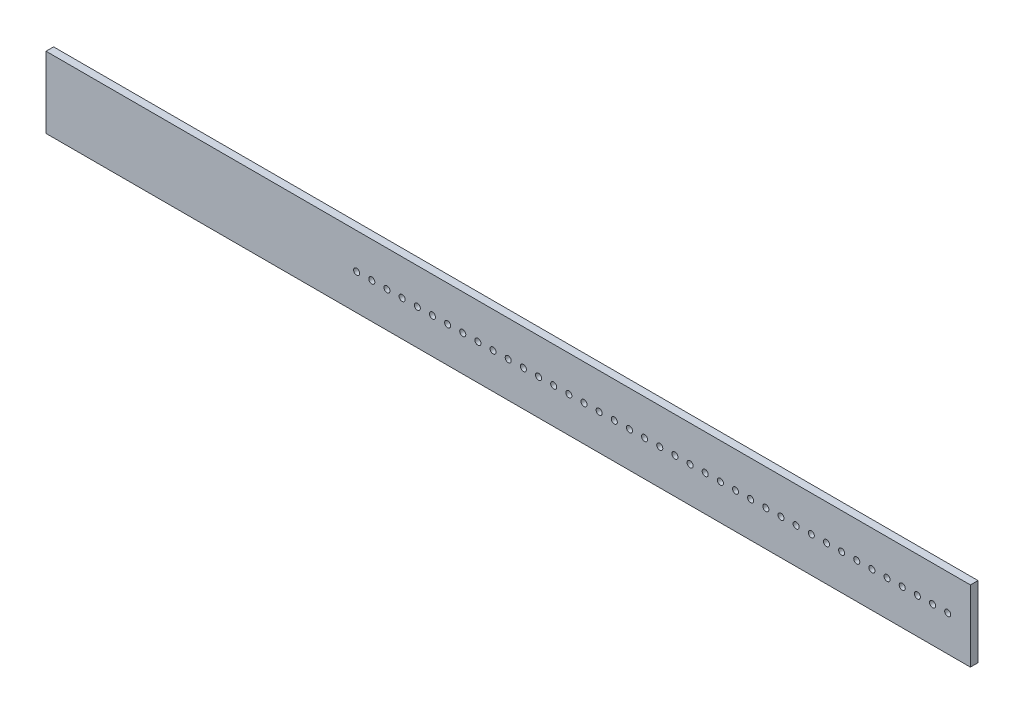
from build123d import *

# Parameters (mm, degrees)
SKETCH_1_W             = 1220
SKETCH_1_H             = 94
EXTRUDE_1_DEPTH        = 10
MM_1_D                 = 8
PATTERN_LINEAR_1_COUNT = 40
PATTERN_LINEAR_1_PITCH = 20


with BuildPart() as part:
    # 草图1 → 凸台-拉伸1 (new body)
    with BuildSketch(Plane.XY):
        Rectangle(SKETCH_1_W, SKETCH_1_H)
    extrude(amount=EXTRUDE_1_DEPTH)

    # 大小mm 暗销孔1 (through all)
    with Locations(Plane(origin=(0, 0, 0), x_dir=(-1, 0, 0), z_dir=(0, 0, -1))):
        with Locations((-580, 0)):
            mm_1 = Hole(MM_1_D / 2)

    # 阵列(线性)1: 大小mm 暗销孔1 ×40
    with Locations(*[(-i * PATTERN_LINEAR_1_PITCH, 0, 0) for i in range(1, PATTERN_LINEAR_1_COUNT)]):
        add(mm_1, mode=Mode.SUBTRACT)


solid = part.part
